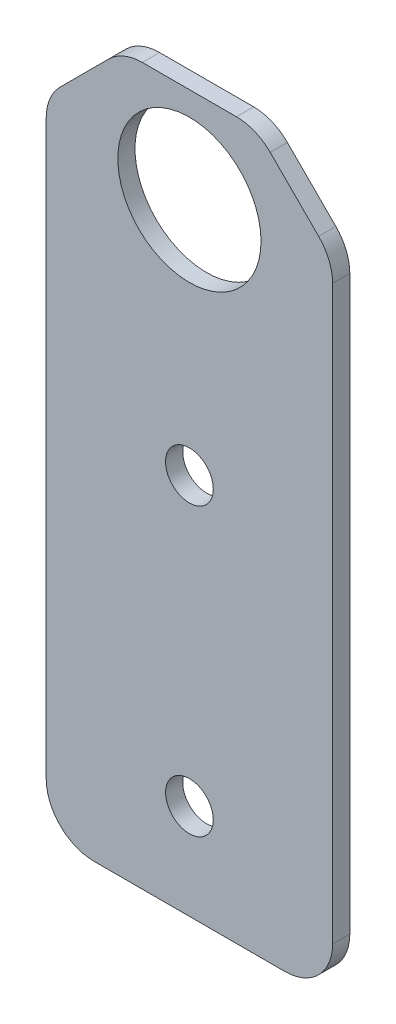
from build123d import *

# Parameters (mm, degrees)
SKETCH1_W           = 38.1
SKETCH1_H           = 101.6
SKETCH1_R           = 3.175
SKETCH1_R_2         = 9.525
BOSS_EXTRUDE1_DEPTH = 1.143
CHAMFER1_SIZE       = 10.16
FILLET1_R           = 6.35
SKETCH2_W           = 38.1
SKETCH2_H           = 6.35
CUT_EXTRUDE1_DEPTH  = 55.302562518
FILLET2_R           = 6.35


with BuildPart() as part:
    # Sketch1 → Boss-Extrude1 (new, symmetric)
    with BuildSketch(Plane.XY):
        Rectangle(SKETCH1_W, SKETCH1_H)
        with Locations((0, -31.75)):
            Circle(SKETCH1_R, mode=Mode.SUBTRACT)
        with Locations((0, 6.35)):
            Circle(SKETCH1_R, mode=Mode.SUBTRACT)
        with Locations((0, 38.1)):
            Circle(SKETCH1_R_2, mode=Mode.SUBTRACT)
    extrude(amount=BOSS_EXTRUDE1_DEPTH, both=True)

    # Chamfer1
    chamfer1_edges = [part.edges().sort_by_distance(p)[0] for p in [
        (-19.05, 50.8, 0),
        (19.05, 50.8, 0),
    ]]
    chamfer(chamfer1_edges, length=CHAMFER1_SIZE)

    # Fillet1
    fillet1_edges = [part.edges().sort_by_distance(p)[0] for p in [
        (-19.05, 40.64, 0),
        (8.89, 50.8, 0),
        (-8.89, 50.8, 0),
        (19.05, 40.64, 0),
        (19.05, -50.8, 0),
        (-19.05, -50.8, 0),
    ]]
    fillet(fillet1_edges, radius=FILLET1_R)

    # Sketch2 → Cut-Extrude1 (cut, through all)
    with BuildSketch(Plane.XY.offset(1.143)):
        with Locations((0, -47.625)):
            Rectangle(SKETCH2_W, SKETCH2_H)
    extrude(amount=-CUT_EXTRUDE1_DEPTH, mode=Mode.SUBTRACT)

    # Fillet2
    fillet2_edges = [part.edges().sort_by_distance(p)[0] for p in [
        (-19.05, -44.45, 0),
        (19.05, -44.45, 0),
    ]]
    fillet(fillet2_edges, radius=FILLET2_R)


solid = part.part
